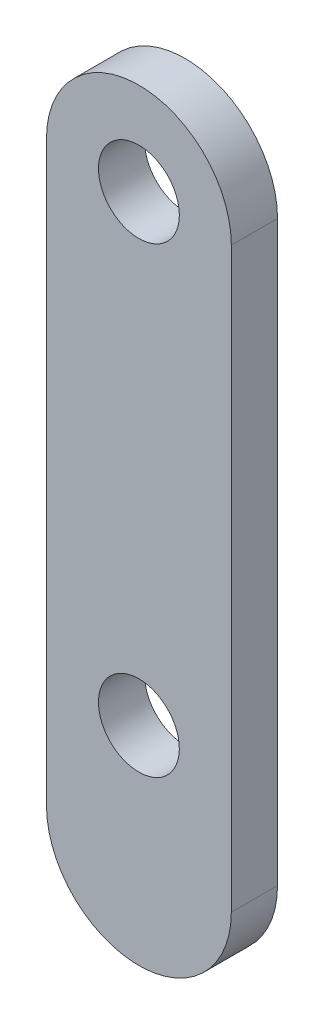
from build123d import *

# Parameters (mm, degrees)
SKETCH_2_R      = 1.75
EXTRUDE_1_DEPTH = 2


with BuildPart() as part:
    # 草图2 → 凸台-拉伸1 (new body)
    with BuildSketch(Plane.XY):
        with BuildLine():
            Line((-4, 0), (-4, 25))
            ThreePointArc((-4, 25), (0, 29), (4, 25))
            Line((4, 25), (4, 0))
            ThreePointArc((4, 0), (0, -4), (-4, 0))
        make_face()
        with Locations((0, 5)):
            Circle(SKETCH_2_R, mode=Mode.SUBTRACT)
        with Locations((0, 25)):
            Circle(SKETCH_2_R, mode=Mode.SUBTRACT)
    extrude(amount=EXTRUDE_1_DEPTH)


solid = part.part
